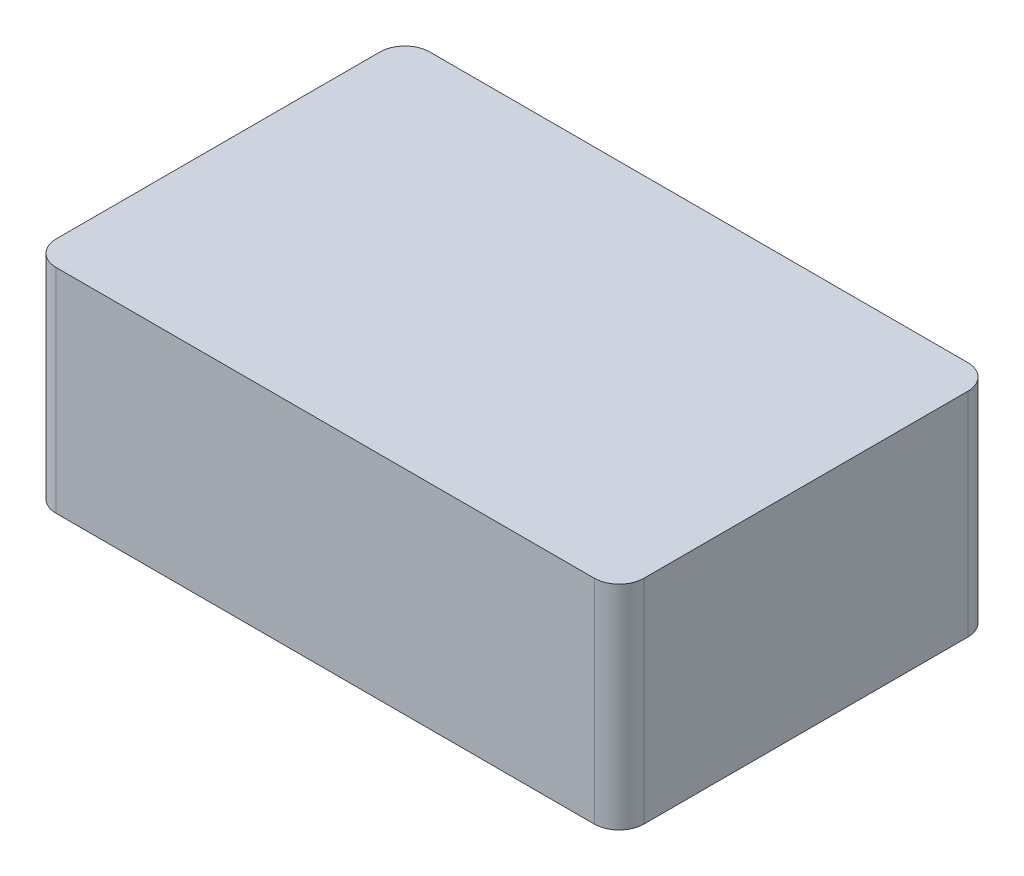
from build123d import *

# Parameters (mm, degrees)
CROQUIS1_W              = 87.5
CROQUIS1_H              = 55.6
SALIENTE_EXTRUIR1_DEPTH = 31.7
REDONDEO1_R             = 3.7


with BuildPart() as part:
    # Croquis1 → Saliente-Extruir1 (new body)
    with BuildSketch(Plane(origin=(0, 0, 0), x_dir=(1, 0, 0), z_dir=(0, 1, 0))):
        Rectangle(CROQUIS1_W, CROQUIS1_H)
    extrude(amount=SALIENTE_EXTRUIR1_DEPTH)

    # Redondeo1
    redondeo1_edges = [part.edges().sort_by_distance(p)[0] for p in [
        (43.75, 15.85, 27.8),
        (-43.75, 15.85, 27.8),
        (-43.75, 15.85, -27.8),
        (43.75, 15.85, -27.8),
    ]]
    fillet(redondeo1_edges, radius=REDONDEO1_R)


solid = part.part
